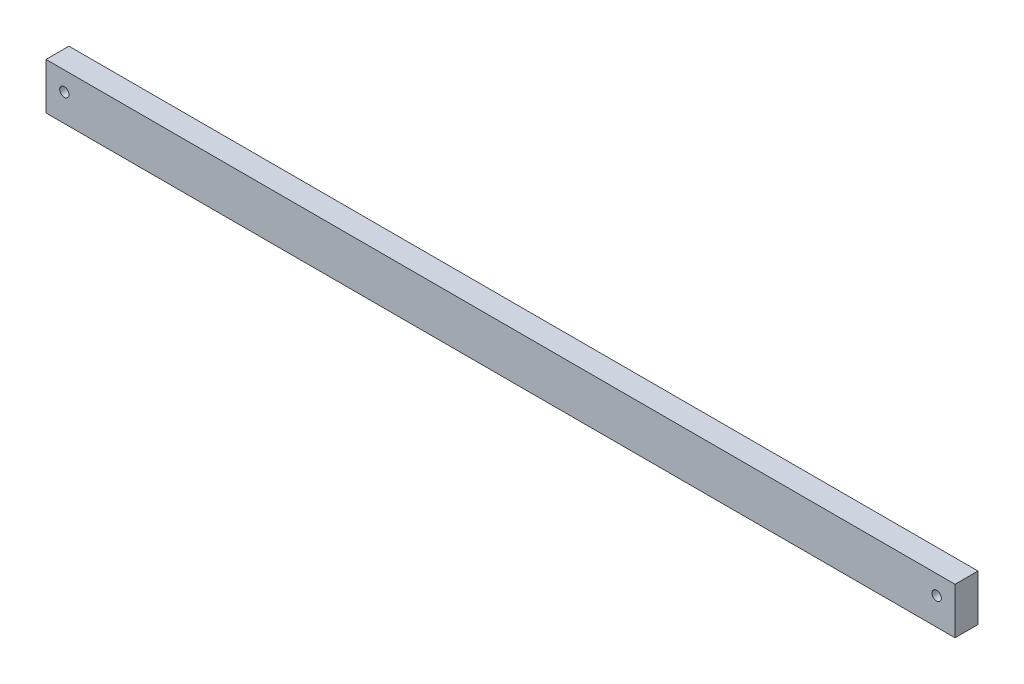
from build123d import *

# Parameters (mm, degrees)
SKETCH1_W           = 1980
SKETCH1_H           = 50
BOSS_EXTRUDE1_DEPTH = 101.05
SKETCH2_R           = 10.16
CUT_EXTRUDE1_DEPTH  = 997.399067894


with BuildPart() as part:
    # Sketch1 → Boss-Extrude1 (new body)
    with BuildSketch(Plane(origin=(0, 0, 0), x_dir=(1, 0, 0), z_dir=(0, 1, 0))):
        with Locations((0, 25)):
            Rectangle(SKETCH1_W, SKETCH1_H)
    extrude(amount=BOSS_EXTRUDE1_DEPTH)

    # Sketch2 → Cut-Extrude1 (cut, through all)
    with BuildSketch(Plane.XY):
        with Locations(Location((-950, 59.525, 0), (0, 0, 180))):
            Circle(SKETCH2_R)
        with Locations(Location((950, 59.525, 0), (0, 0, 180))):
            Circle(SKETCH2_R)
    extrude(amount=-CUT_EXTRUDE1_DEPTH, mode=Mode.SUBTRACT)


solid = part.part
